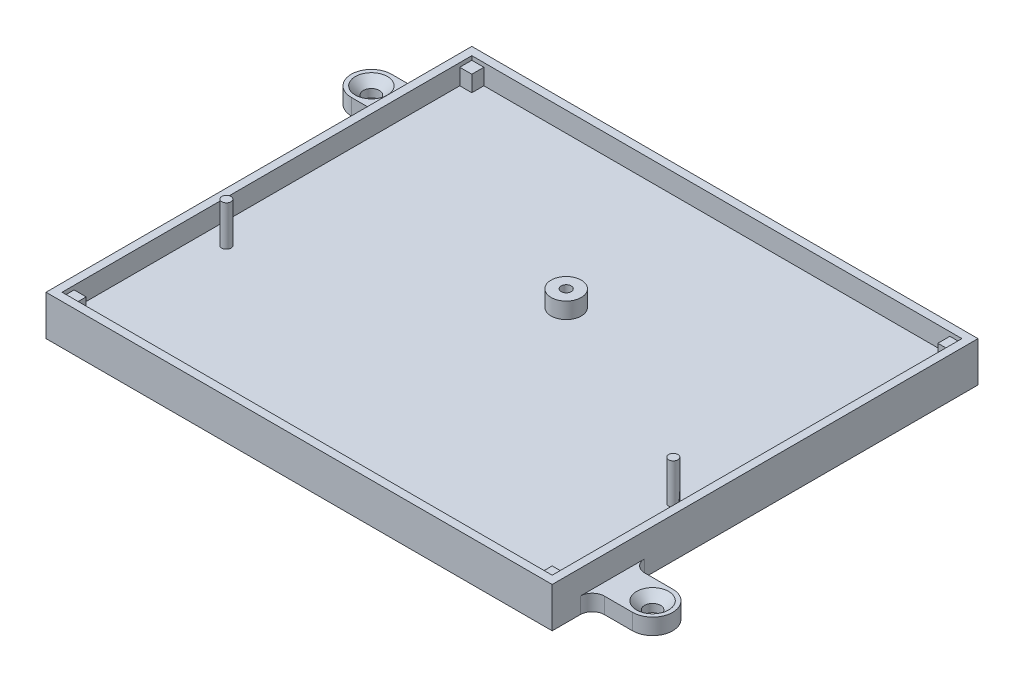
from build123d import *

# Parameters (mm, degrees)
SKETCH1_W                       = 126
SKETCH1_H                       = 106
BOSS_EXTRUDE1_DEPTH             = 5
SKETCH3_W                       = 126
SKETCH3_H                       = 106
SKETCH3_W_2                     = 122
SKETCH3_H_2                     = 102
BOSS_EXTRUDE3_DEPTH             = 5
BOSS_EXTRUDE5_DEPTH             = 4
FILLET1_R                       = 3
F_4_0MM_DOWEL_HOLE1_D           = 4
F_4_0MM_DOWEL_HOLE1_CSINK_D     = 8
F_4_0MM_DOWEL_HOLE1_CSINK_ANGLE = 90
SKETCH17_R                      = 1.15
BOSS_EXTRUDE6_DEPTH             = 10
SKETCH18_W                      = 3
SKETCH18_H                      = 3
BOSS_EXTRUDE7_DEPTH             = 4
SKETCH4_R                       = 3.75
BOSS_EXTRUDE8_DEPTH             = 4
F_2_5MM_DOWEL_HOLE1_D           = 2.5


with BuildPart() as part:
    # Sketch1 → Boss-Extrude1 (new body)
    with BuildSketch(Plane(origin=(0, 0, 0), x_dir=(1, 0, 0), z_dir=(0, 1, 0))):
        Rectangle(SKETCH1_W, SKETCH1_H)
    extrude(amount=BOSS_EXTRUDE1_DEPTH)

    # Sketch3 → Boss-Extrude3 (add)
    with BuildSketch(Plane(origin=(0, 5, 0), x_dir=(1, 0, 0), z_dir=(0, 1, 0))):
        Rectangle(SKETCH3_W, SKETCH3_H)
        Rectangle(SKETCH3_W_2, SKETCH3_H_2, mode=Mode.SUBTRACT)
    extrude(amount=BOSS_EXTRUDE3_DEPTH)

    # Sketch7 → Boss-Extrude5 (add)
    with BuildSketch(Plane(origin=(0, 0, 0), x_dir=(1, 0, 0), z_dir=(0, 1, 0))):
        with BuildLine():
            Line((-63, 43), (-73, 43))
            ThreePointArc((-73, 43), (-78, 38), (-73, 33))
            Line((-73, 33), (-63, 33))
            Line((-63, 33), (-63, 43))
        make_face()
        with BuildLine():
            Line((63, -33), (73, -33))
            ThreePointArc((73, -33), (78, -38), (73, -43))
            Line((73, -43), (63, -43))
            Line((63, -43), (63, -33))
        make_face()
    extrude(amount=BOSS_EXTRUDE5_DEPTH)

    # Fillet1
    fillet1_edges = [part.edges().sort_by_distance(p)[0] for p in [
        (-63, 2, -33),
        (-63, 2, -43),
        (63, 2, 33),
        (63, 2, 43),
    ]]
    fillet(fillet1_edges, radius=FILLET1_R)

    # Ø4.0mm Dowel Hole1 (through all)
    with Locations(Plane(origin=(0, 4, 0), x_dir=(1, 0, 0), z_dir=(0, 1, 0))):
        with Locations((-73, 38), (73, -38)):
            CounterSinkHole(F_4_0MM_DOWEL_HOLE1_D / 2, F_4_0MM_DOWEL_HOLE1_CSINK_D / 2, counter_sink_angle=F_4_0MM_DOWEL_HOLE1_CSINK_ANGLE)

    # Sketch17 → Boss-Extrude6 (add)
    with BuildSketch(Plane(origin=(0, 5, 0), x_dir=(1, 0, 0), z_dir=(0, 1, 0))):
        with Locations(Location((-55.626, -15.47, 0), (0, 0, 90))):
            Circle(SKETCH17_R)
        with Locations(Location((55.626, -15.47, 0), (0, 0, 90))):
            Circle(SKETCH17_R)
    extrude(amount=BOSS_EXTRUDE6_DEPTH)

    # Sketch18 → Boss-Extrude7 (add)
    with BuildSketch(Plane(origin=(0, 5, 0), x_dir=(1, 0, 0), z_dir=(0, 1, 0))):
        with Locations((-59.5, 49.5)):
            Rectangle(SKETCH18_W, SKETCH18_H)
        with Locations((59.5, 49.5)):
            Rectangle(SKETCH18_W, SKETCH18_H)
        with Locations((-59.5, -49.5)):
            Rectangle(SKETCH18_W, SKETCH18_H)
        with Locations((59.5, -49.5)):
            Rectangle(SKETCH18_W, SKETCH18_H)
    extrude(amount=BOSS_EXTRUDE7_DEPTH)

    # Sketch4 → Boss-Extrude8 (add)
    with BuildSketch(Plane(origin=(0, 5, 0), x_dir=(1, 0, 0), z_dir=(0, 1, 0))):
        with Locations(Location((0, 13.486, 0), (0, 0, 90))):
            Circle(SKETCH4_R)
    extrude(amount=BOSS_EXTRUDE8_DEPTH)

    # Ø2.5mm Dowel Hole1 (through all)
    with Locations(Plane(origin=(0, 9, 0), x_dir=(1, 0, 0), z_dir=(0, 1, 0))):
        with Locations((0, 13.486)):
            Hole(F_2_5MM_DOWEL_HOLE1_D / 2)


solid = part.part
